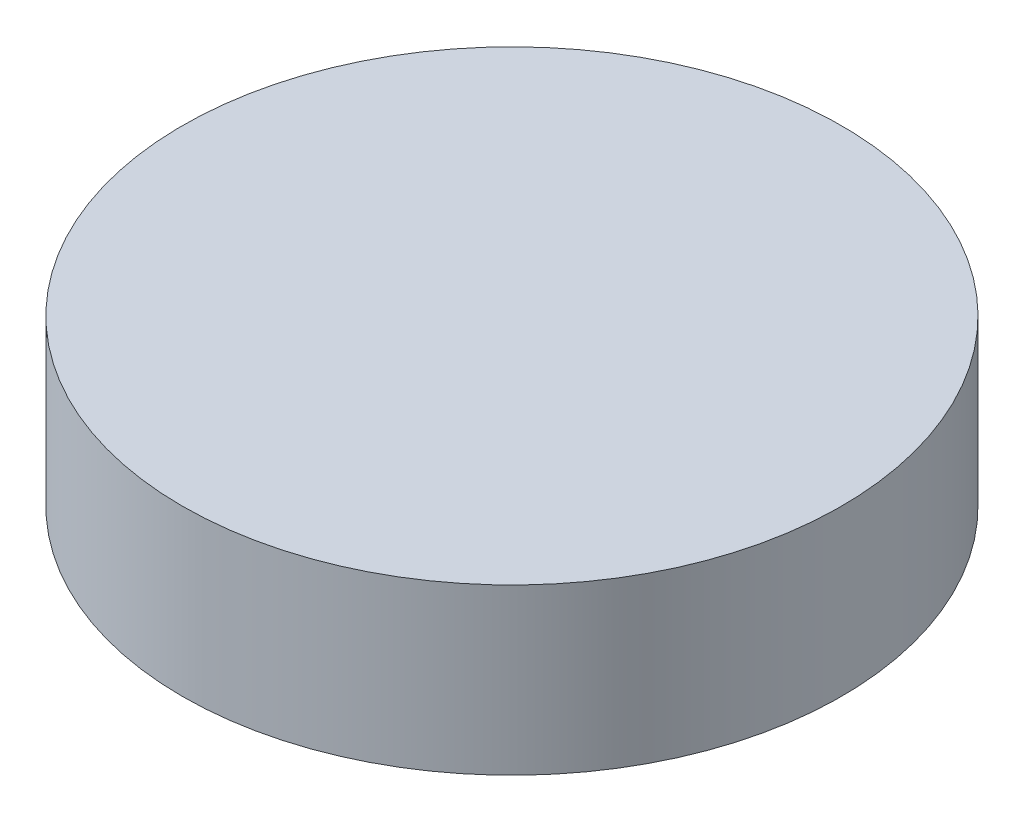
from build123d import *

# Parameters (mm, degrees)
SKETCH1_R           = 3.175
BOSS_EXTRUDE1_DEPTH = 1.5875


with BuildPart() as part:
    # Sketch1 → Boss-Extrude1 (new body)
    with BuildSketch(Plane(origin=(0, 0, 0), x_dir=(1, 0, 0), z_dir=(0, 1, 0))):
        with Locations(Location((0, 0, 0), (0, 0, 270))):
            Circle(SKETCH1_R)
    extrude(amount=BOSS_EXTRUDE1_DEPTH)


solid = part.part
